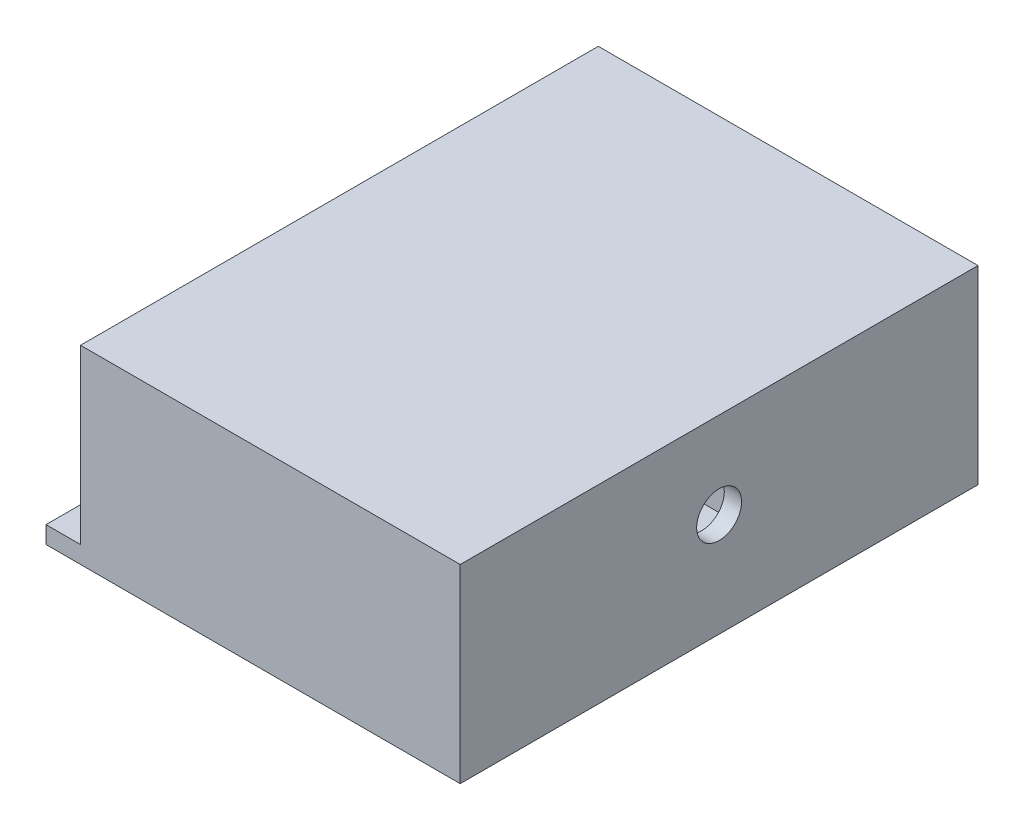
from build123d import *

# Parameters (mm, degrees)
SKETCH3_W           = 120
SKETCH3_H           = 150
BOSS_EXTRUDE2_DEPTH = 5
BOSS_EXTRUDE3_DEPTH = 45
SKETCH5_W           = 110
SKETCH5_H           = 150
BOSS_EXTRUDE4_DEPTH = 5
SKETCH6_R           = 6.5
CUT_EXTRUDE1_DEPTH  = 5
SKETCH7_W           = 40
SKETCH7_H           = 140
BOSS_EXTRUDE5_DEPTH = 8
SKETCH8_W           = 40
SKETCH8_H           = 5
BOSS_EXTRUDE6_DEPTH = 25.5
SKETCH9_R           = 1.5
CUT_EXTRUDE2_DEPTH  = 10
SKETCH10_W          = 47.5
SKETCH10_H          = 8
CUT_EXTRUDE3_DEPTH  = 40
SKETCH11_W          = 45
SKETCH11_H          = 33.5
CUT_EXTRUDE4_DEPTH  = 40
SKETCH12_W          = 56
SKETCH12_H          = 15
BOSS_EXTRUDE7_DEPTH = 40
SKETCH13_W          = 7
SKETCH13_H          = 20.5
BOSS_EXTRUDE8_DEPTH = 11
SKETCH14_W          = 56
SKETCH14_H          = 5
BOSS_EXTRUDE9_DEPTH = 11


with BuildPart() as part:
    # Sketch3 → Boss-Extrude2 (new body)
    with BuildSketch(Plane(origin=(0, 0, 0), x_dir=(1, 0, 0), z_dir=(0, 1, 0))):
        with Locations((60, 75)):
            Rectangle(SKETCH3_W, SKETCH3_H)
    extrude(amount=BOSS_EXTRUDE2_DEPTH)

    # Sketch4 → Boss-Extrude3 (add)
    with BuildSketch(Plane(origin=(0, 5, 0), x_dir=(1, 0, 0), z_dir=(0, 1, 0))):
        Polygon((10, 0), (10, 5), (115, 5), (115, 145), (10, 145), (10, 150), (120, 150), (120, 0), align=None)
    extrude(amount=BOSS_EXTRUDE3_DEPTH)

    # Sketch5 → Boss-Extrude4 (add)
    with BuildSketch(Plane(origin=(0, 50, 0), x_dir=(1, 0, 0), z_dir=(0, 1, 0))):
        with Locations((65, 75)):
            Rectangle(SKETCH5_W, SKETCH5_H)
    extrude(amount=BOSS_EXTRUDE4_DEPTH)

    # Sketch6 → Cut-Extrude1 (cut)
    with BuildSketch(Plane(origin=(120, 0, 0), x_dir=(0, 0, -1), z_dir=(1, 0, 0))):
        with Locations((75, 30)):
            Circle(SKETCH6_R)
    extrude(amount=-CUT_EXTRUDE1_DEPTH, mode=Mode.SUBTRACT)

    # Sketch7 → Boss-Extrude5 (add)
    with BuildSketch(Plane(origin=(0, 5, 0), x_dir=(1, 0, 0), z_dir=(0, 1, 0))):
        with Locations((95, 75)):
            Rectangle(SKETCH7_W, SKETCH7_H)
    extrude(amount=BOSS_EXTRUDE5_DEPTH)

    # Sketch8 → Boss-Extrude6 (add)
    with BuildSketch(Plane(origin=(0, 13, 0), x_dir=(1, 0, 0), z_dir=(0, 1, 0))):
        with Locations((95, 55)):
            Rectangle(SKETCH8_W, SKETCH8_H)
        with Locations((95, 95)):
            Rectangle(SKETCH8_W, SKETCH8_H)
    extrude(amount=BOSS_EXTRUDE6_DEPTH)

    # Sketch9 → Cut-Extrude2 (cut)
    with BuildSketch(Plane.ZY.offset(-10)):
        with Locations((-147.5, 10)):
            Circle(SKETCH9_R)
        with Locations((-147.5, 52.5)):
            Circle(SKETCH9_R)
        with Locations((-2.5, 10)):
            Circle(SKETCH9_R)
        with Locations((-2.5, 52.5)):
            Circle(SKETCH9_R)
    extrude(amount=-CUT_EXTRUDE2_DEPTH, mode=Mode.SUBTRACT)

    # Sketch10 → Cut-Extrude3 (cut)
    with BuildSketch(Plane.ZY.offset(-75)):
        with Locations((-121.25, 9)):
            Rectangle(SKETCH10_W, SKETCH10_H)
        with Locations((-28.75, 9)):
            Rectangle(SKETCH10_W, SKETCH10_H)
    extrude(amount=-CUT_EXTRUDE3_DEPTH, mode=Mode.SUBTRACT)

    # Sketch11 → Cut-Extrude4 (cut)
    with BuildSketch(Plane.ZY.offset(-75)):
        with Locations((-75, 21.75)):
            Rectangle(SKETCH11_W, SKETCH11_H)
    extrude(amount=-CUT_EXTRUDE4_DEPTH, mode=Mode.SUBTRACT)

    # Sketch12 → Boss-Extrude7 (add)
    with BuildSketch(Plane.ZY.offset(-115)):
        with Locations((-64.5, 12.5)):
            Rectangle(SKETCH12_W, SKETCH12_H)
    extrude(amount=BOSS_EXTRUDE7_DEPTH)

    # Sketch13 → Boss-Extrude8 (add)
    with BuildSketch(Plane.ZY.offset(-115)):
        with Locations((-89, 30.25)):
            Rectangle(SKETCH13_W, SKETCH13_H)
        with Locations((-40, 30.25)):
            Rectangle(SKETCH13_W, SKETCH13_H)
    extrude(amount=BOSS_EXTRUDE8_DEPTH)

    # Sketch14 → Boss-Extrude9 (add)
    with BuildSketch(Plane.ZY.offset(-115)):
        with Locations((-64.5, 43)):
            Rectangle(SKETCH14_W, SKETCH14_H)
    extrude(amount=BOSS_EXTRUDE9_DEPTH)


solid = part.part
